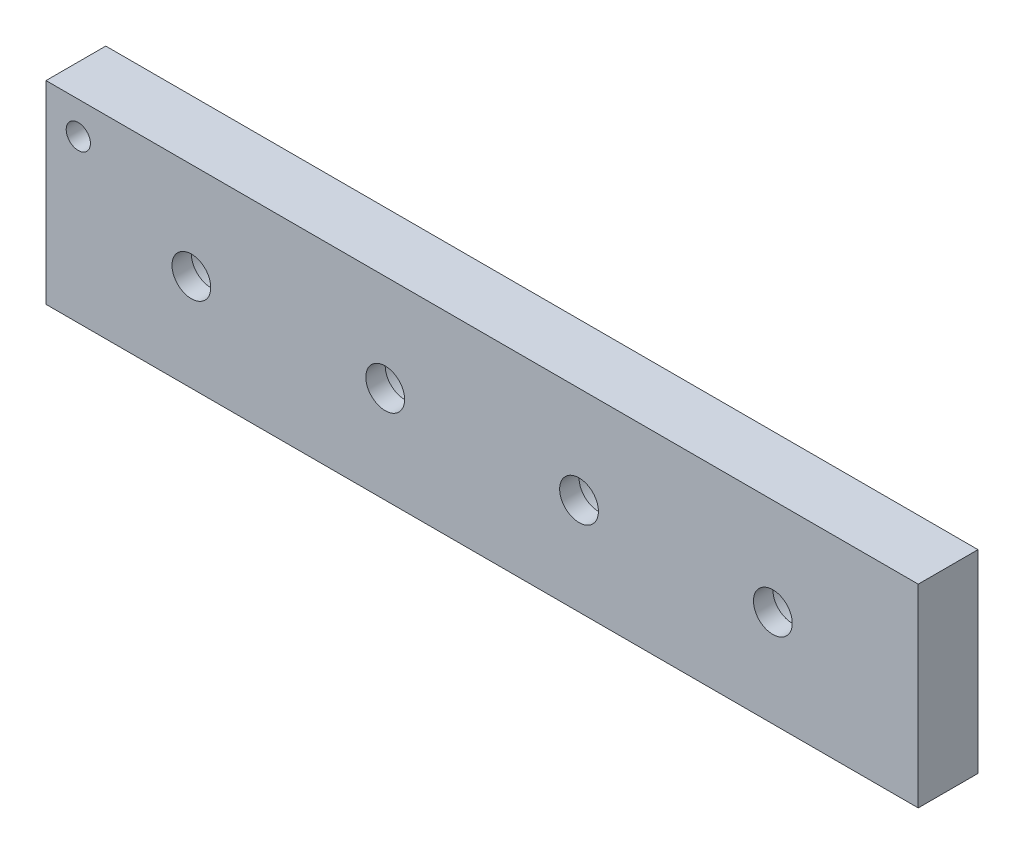
from build123d import *

# Parameters (mm, degrees)
COUPON_BAR_54X12X3P7_PROFILE_W                 = 54
COUPON_BAR_54X12X3P7_PROFILE_H                 = 12
COUPON_BAR_54X12X3P7_DEPTH                     = 3.7
PRESS_SOCKETS_4P65_4P75_4P85_4P95_DE_2_R       = 2.325
PRESS_SOCKETS_4P65_4P75_4P85_4P95_DE_2_R_2     = 2.375
PRESS_SOCKETS_4P65_4P75_4P85_4P95_DE_2_R_3     = 2.425
PRESS_SOCKETS_4P65_4P75_4P85_4P95_DE_2_R_4     = 2.475
PRESS_SOCKETS_4P65_4P75_4P85_4P95_DEPTH2_DEPTH = 2.5
M2_CENTRE_SCREW_CLEARANCE_START                = -50
M2_CENTRE_SCREW_CLEARANCE_PROFILE_R            = 1.2
M2_CENTRE_SCREW_CLEARANCE_DEPTH                = 78.90501747
ORIENTATION_MARK_AT_SMALLEST_SOCKET_START      = -50
ORIENTATION_MARK_AT_SMALLEST_SOCKET_PROF_R     = 0.75
ORIENTATION_MARK_AT_SMALLEST_SOCKET_DEPTH      = 78.90501747


with BuildPart() as part:
    # Coupon_bar_54x12x3p7_profile → Coupon_bar_54x12x3p7 (new body)
    with BuildSketch(Plane.XY):
        Rectangle(COUPON_BAR_54X12X3P7_PROFILE_W, COUPON_BAR_54X12X3P7_PROFILE_H)
    extrude(amount=COUPON_BAR_54X12X3P7_DEPTH)

    # Press_sockets_4p65_4p75_4p85_4p95_de 2 → Press_sockets_4p65_4p75_4p85_4p95_depth2 (cut)
    with BuildSketch(Plane.XY):
        with Locations((-18, 0)):
            Circle(PRESS_SOCKETS_4P65_4P75_4P85_4P95_DE_2_R)
        with Locations((-6, 0)):
            Circle(PRESS_SOCKETS_4P65_4P75_4P85_4P95_DE_2_R_2)
        with Locations((6, 0)):
            Circle(PRESS_SOCKETS_4P65_4P75_4P85_4P95_DE_2_R_3)
        with Locations((18, 0)):
            Circle(PRESS_SOCKETS_4P65_4P75_4P85_4P95_DE_2_R_4)
    extrude(amount=PRESS_SOCKETS_4P65_4P75_4P85_4P95_DEPTH2_DEPTH, mode=Mode.SUBTRACT)

    # M2_centre_screw_clearance_profile → M2_centre_screw_clearance (cut, through all)
    with BuildSketch(Plane.XY.offset(M2_CENTRE_SCREW_CLEARANCE_START)):
        with Locations(Location((-18, 0, 0), (0, 0, 180))):
            Circle(M2_CENTRE_SCREW_CLEARANCE_PROFILE_R)
        with Locations(Location((-6, 0, 0), (0, 0, 180))):
            Circle(M2_CENTRE_SCREW_CLEARANCE_PROFILE_R)
        with Locations(Location((6, 0, 0), (0, 0, 180))):
            Circle(M2_CENTRE_SCREW_CLEARANCE_PROFILE_R)
        with Locations(Location((18, 0, 0), (0, 0, 180))):
            Circle(M2_CENTRE_SCREW_CLEARANCE_PROFILE_R)
    extrude(amount=M2_CENTRE_SCREW_CLEARANCE_DEPTH, mode=Mode.SUBTRACT)

    # Orientation_mark_at_smallest_socket_profile → Orientation_mark_at_smallest_socket (cut, through all)
    with BuildSketch(Plane.XY.offset(ORIENTATION_MARK_AT_SMALLEST_SOCKET_START)):
        with Locations(Location((-25, 4, 0), (0, 0, 180))):
            Circle(ORIENTATION_MARK_AT_SMALLEST_SOCKET_PROF_R)
    extrude(amount=ORIENTATION_MARK_AT_SMALLEST_SOCKET_DEPTH, mode=Mode.SUBTRACT)


solid = part.part
